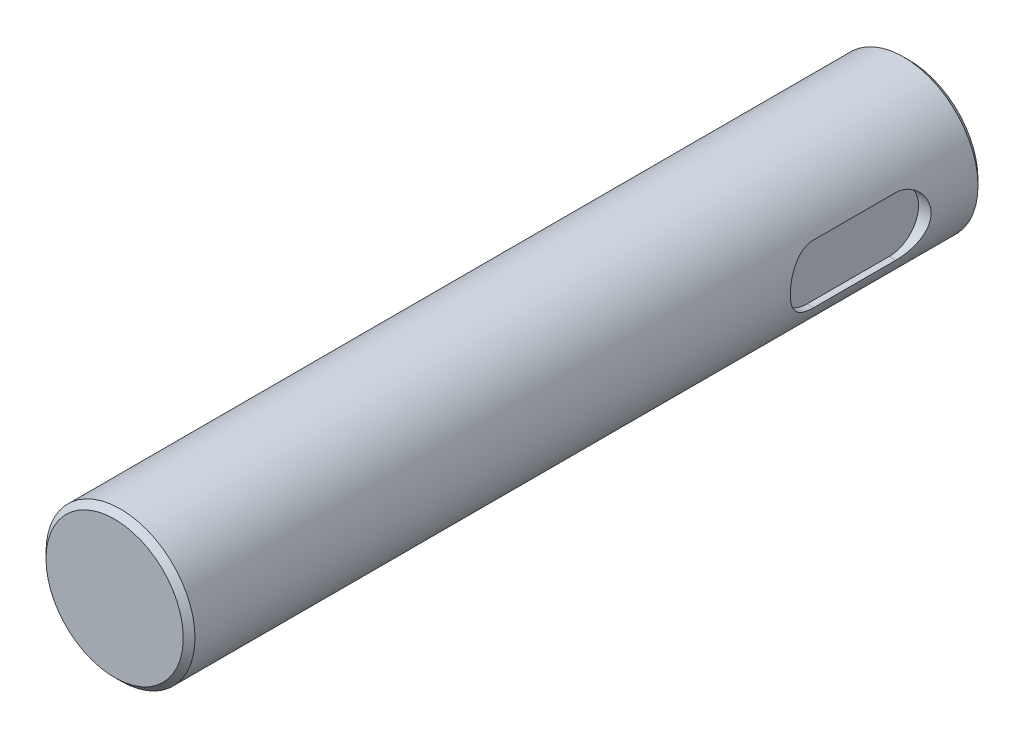
from build123d import *

# Parameters (mm, degrees)
SKETCH_1_W          = 67.75
SKETCH_1_H          = 6.35
CHAMFER_1_SIZE      = 0.5
CUT_EXTRUDE_1_DEPTH = 1.075


with BuildPart() as part:
    # Эскиз1 → Повернуть1 (revolve)
    with BuildSketch(Plane(origin=(0, 0, 0), x_dir=(0, 0, -1), z_dir=(1, 0, 0)), mode=Mode.PRIVATE) as revolve_1_sk:
        with Locations((33.875, 3.175)):
            Rectangle(SKETCH_1_W, SKETCH_1_H)
    revolve(revolve_1_sk.sketch.rotate(Axis((0, 0, 0), (0, 0, -1)), 90), axis=Axis((0, 0, 0), (0, 0, -1)))

    # Фаска1
    chamfer_1_edges = [part.edges().sort_by_distance(p)[0] for p in [
        (-6.35, 0, 0),
        (-6.35, 0, -67.75),
    ]]
    chamfer(chamfer_1_edges, length=CHAMFER_1_SIZE)

    # Эскиз2 → Вырез-Вытянуть1 (cut)
    with BuildSketch(Plane(origin=(6.35, 0, 0), x_dir=(0, 0, -1), z_dir=(1, 0, 0))):
        with BuildLine():
            Line((53.75, 2.5), (60.75, 2.5))
            ThreePointArc((60.75, 2.5), (63.25, 0), (60.75, -2.5))
            Line((60.75, -2.5), (53.75, -2.5))
            ThreePointArc((53.75, -2.5), (51.25, 0), (53.75, 2.5))
        make_face()
    extrude(amount=-CUT_EXTRUDE_1_DEPTH, mode=Mode.SUBTRACT)


solid = part.part
